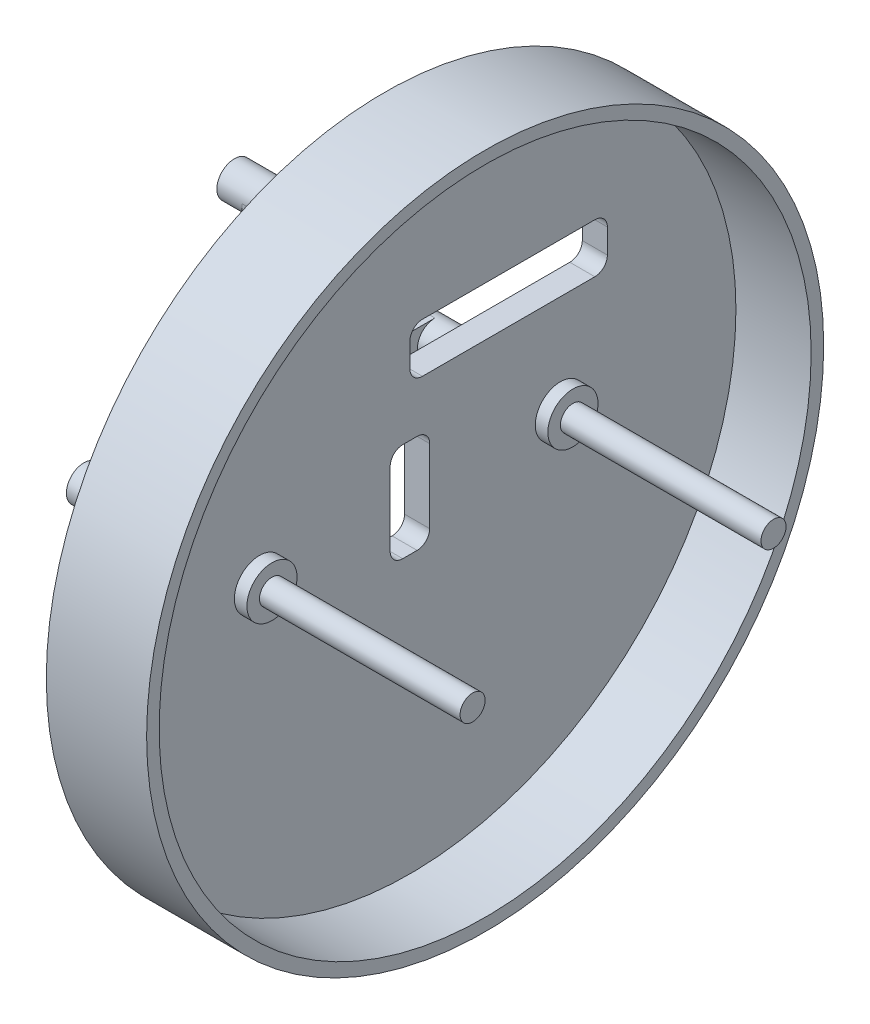
from build123d import *

# Parameters (mm, degrees)
BOSS_EXTRUDE1_DEPTH      = 2.54
BOSS_EXTRUDE2_DEPTH      = 2.54
BOSS_EXTRUDE2_DEPTH_BACK = 12.7
SKETCH3_R                = 1.778
SKETCH4_R                = 34.29
BOSS_EXTRUDE3_DEPTH      = 10.16
BOSS_EXTRUDE4_DEPTH      = 2.54
BOSS_EXTRUDE5_DEPTH      = 10.16
BOSS_EXTRUDE5_DEPTH_BACK = 5.08
SKETCH6_R                = 1.778
SKETCH7_R                = 33.02
CUT_EXTRUDE1_DEPTH       = 7.62
SKETCH9_R                = 2.54
BOSS_EXTRUDE6_DEPTH      = 1.27
SKETCH10_R               = 1.27
BOSS_EXTRUDE7_DEPTH      = 20.32
CUT_EXTRUDE2_REACH       = 65.993
CUT_EXTRUDE3_REACH       = 65.993


with BuildPart() as part:
    # Sketch2 → Boss-Extrude1 (new body)
    with BuildSketch(Plane(origin=(0, 0, 0), x_dir=(0, 0, -1), z_dir=(1, 0, 0))):
        with BuildLine():
            Line((0, -1.778), (30.48, -1.778))
            ThreePointArc((30.48, -1.778), (32.258, 0), (30.48, 1.778))
            Line((30.48, 1.778), (0, 1.778))
            ThreePointArc((0, 1.778), (-1.778, 0), (0, -1.778))
        make_face()
    extrude(amount=BOSS_EXTRUDE1_DEPTH)

    # Sketch3 → Boss-Extrude2 (add, two sides: drawn at the far end of the back side and taken through both)
    with BuildSketch(Plane.ZY.offset(-BOSS_EXTRUDE2_DEPTH_BACK)):
        with Locations((-30.48, 0)):
            Circle(SKETCH3_R)
        Circle(SKETCH3_R)
    extrude(amount=BOSS_EXTRUDE2_DEPTH + BOSS_EXTRUDE2_DEPTH_BACK)

    # Sketch4 → Boss-Extrude3 (add)
    with BuildSketch(Plane(origin=(12.7, 0, 0), x_dir=(0, 0, -1), z_dir=(1, 0, 0))):
        with Locations((15.24, 0)):
            Circle(SKETCH4_R)
    extrude(amount=BOSS_EXTRUDE3_DEPTH)

    # Sketch5 → Boss-Extrude4 (add)
    with BuildSketch(Plane(origin=(0, 0, 0), x_dir=(0, 0, -1), z_dir=(1, 0, 0))):
        with BuildLine():
            Line((13.462, -19.05), (13.462, 19.05))
            ThreePointArc((13.462, 19.05), (15.24, 20.828), (17.018, 19.05))
            Line((17.018, 19.05), (17.018, -19.05))
            ThreePointArc((17.018, -19.05), (15.24, -20.828), (13.462, -19.05))
        make_face()
    extrude(amount=BOSS_EXTRUDE4_DEPTH)

    # Sketch6 → Boss-Extrude5 (add, two sides: drawn at the far end of the back side and taken through both)
    with BuildSketch(Plane(origin=(2.54, 0, 0), x_dir=(0, 0, -1), z_dir=(1, 0, 0)).offset(-BOSS_EXTRUDE5_DEPTH_BACK)):
        with Locations((15.24, -19.05)):
            Circle(SKETCH6_R)
        with Locations((15.24, 19.05)):
            Circle(SKETCH6_R)
    extrude(amount=BOSS_EXTRUDE5_DEPTH + BOSS_EXTRUDE5_DEPTH_BACK)

    # Sketch7 → Cut-Extrude1 (cut)
    with BuildSketch(Plane(origin=(22.86, 0, 0), x_dir=(0, 0, -1), z_dir=(1, 0, 0))):
        with Locations((15.24, 0)):
            Circle(SKETCH7_R)
    extrude(amount=-CUT_EXTRUDE1_DEPTH, mode=Mode.SUBTRACT)

    # Sketch9 → Boss-Extrude6 (add)
    with BuildSketch(Plane(origin=(15.24, 0, 0), x_dir=(0, 0, -1), z_dir=(1, 0, 0))):
        Circle(SKETCH9_R)
        with Locations((30.48, 0)):
            Circle(SKETCH9_R)
    extrude(amount=BOSS_EXTRUDE6_DEPTH)

    # Sketch10 → Boss-Extrude7 (add)
    with BuildSketch(Plane(origin=(16.51, 0, 0), x_dir=(0, 0, -1), z_dir=(1, 0, 0))):
        with Locations((30.48, 0)):
            Circle(SKETCH10_R)
        Circle(SKETCH10_R)
    extrude(amount=BOSS_EXTRUDE7_DEPTH)

    # Sketch11 → Cut-Extrude2 (cut, up to next)
    with BuildSketch(Plane(origin=(15.24, 0, 0), x_dir=(0, 0, -1), z_dir=(1, 0, 0)), mode=Mode.PRIVATE) as cut_extrude2_sk1:
        with BuildLine():
            Line((14.51, 5), (15.97, 5))
            ThreePointArc((15.97, 5), (16.868025612, 4.628025612), (17.24, 3.73))
            Line((17.24, 3.73), (17.24, -3.73))
            ThreePointArc((17.24, -3.73), (16.868025612, -4.628025612), (15.97, -5))
            Line((15.97, -5), (14.51, -5))
            ThreePointArc((14.51, -5), (13.611974388, -4.628025612), (13.24, -3.73))
            Line((13.24, -3.73), (13.24, 3.73))
            ThreePointArc((13.24, 3.73), (13.611974388, 4.628025612), (14.51, 5))
        make_face()
    cut_extrude2_tool1 = extrude(cut_extrude2_sk1.sketch, amount=-CUT_EXTRUDE2_REACH, mode=Mode.PRIVATE) & part.part
    add(cut_extrude2_tool1.solids().sort_by_distance((15.24, 0, -15.24))[0], mode=Mode.SUBTRACT)

    # Sketch15 → Cut-Extrude3 (cut, up to next)
    with BuildSketch(Plane(origin=(15.24, 0, 0), x_dir=(0, 0, -1), z_dir=(1, 0, 0)), mode=Mode.PRIVATE) as cut_extrude3_sk1:
        with BuildLine():
            Line((16.51, 10), (33.97, 10))
            ThreePointArc((33.97, 10), (34.868025612, 10.371974388), (35.24, 11.27))
            Line((35.24, 11.27), (35.24, 13.73))
            ThreePointArc((35.24, 13.73), (34.868025612, 14.628025612), (33.97, 15))
            Line((33.97, 15), (16.51, 15))
            ThreePointArc((16.51, 15), (15.611974388, 14.628025612), (15.24, 13.73))
            Line((15.24, 13.73), (15.24, 11.27))
            ThreePointArc((15.24, 11.27), (15.611974388, 10.371974388), (16.51, 10))
        make_face()
    cut_extrude3_tool1 = extrude(cut_extrude3_sk1.sketch, amount=-CUT_EXTRUDE3_REACH, mode=Mode.PRIVATE) & part.part
    add(cut_extrude3_tool1.solids().sort_by_distance((15.24, 12.5, -25.24))[0], mode=Mode.SUBTRACT)


solid = part.part
